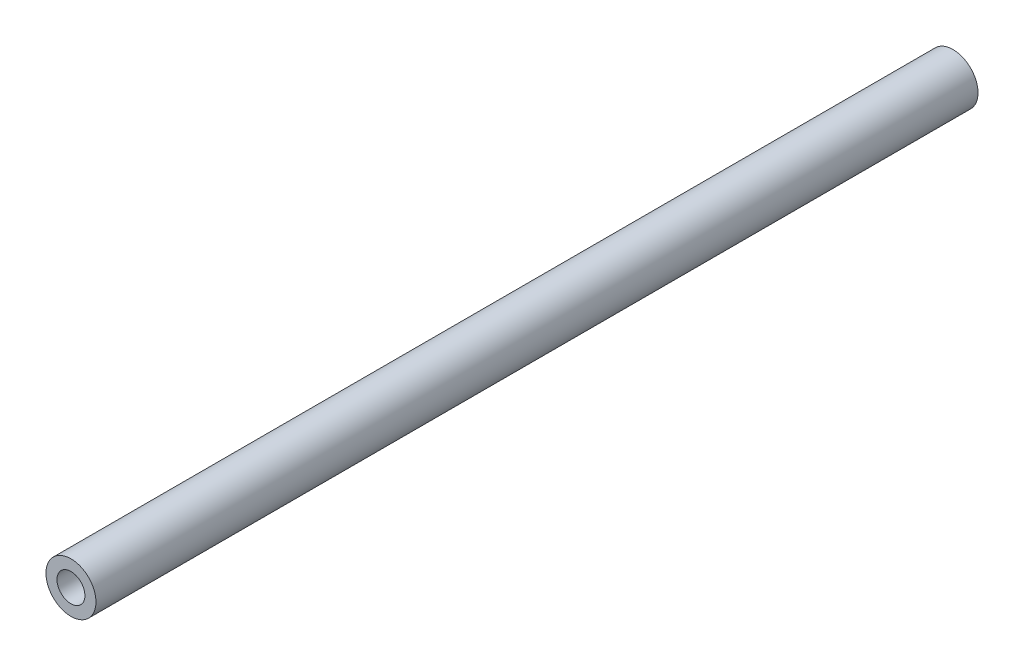
from build123d import *

# Parameters (mm, degrees)
IZIM1_R                     = 8.5
IZIM1_R_2                   = 4.75
Y_KSEKLIK_EKSTR_ZYON1_DEPTH = 300


with BuildPart() as part:
    # Çizim1 → Yükseklik-Ekstrüzyon1 (new body)
    with BuildSketch(Plane.XY):
        Circle(IZIM1_R)
        Circle(IZIM1_R_2, mode=Mode.SUBTRACT)
    extrude(amount=Y_KSEKLIK_EKSTR_ZYON1_DEPTH)


solid = part.part
